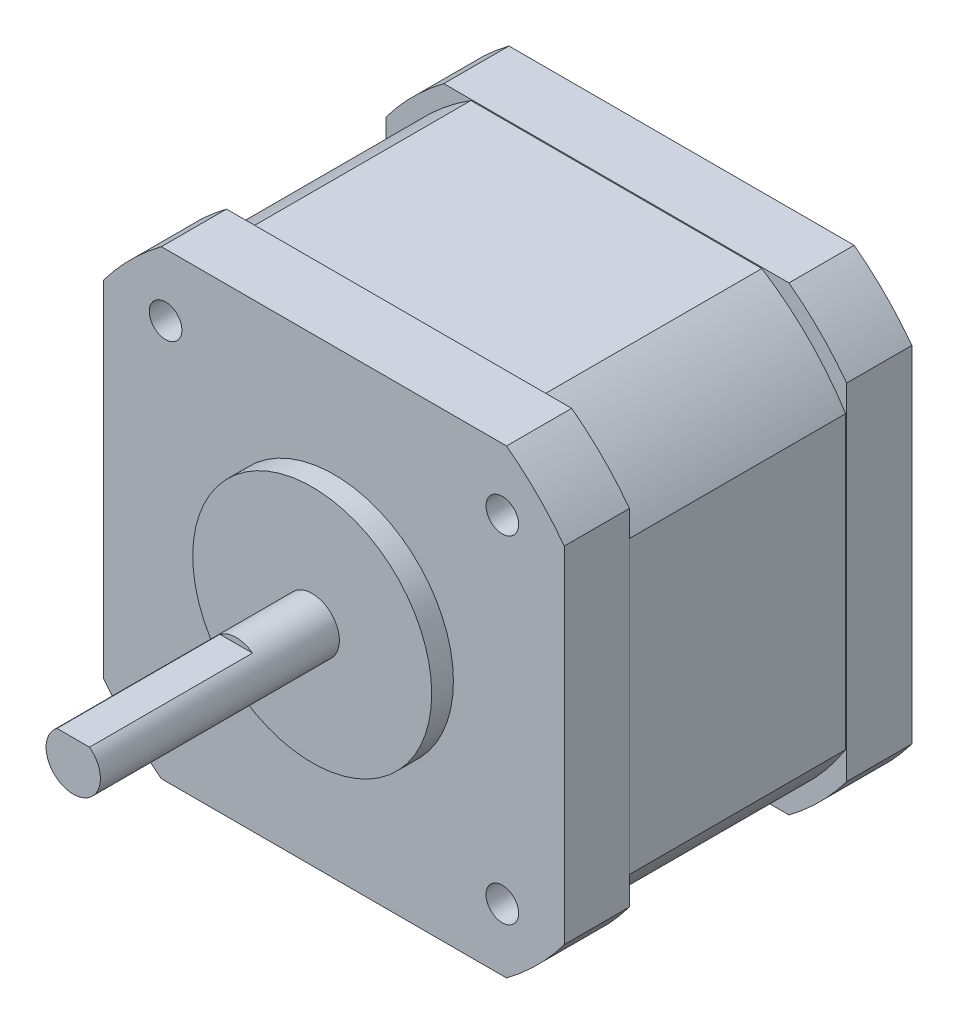
from build123d import *

# Parameters (mm, degrees)
SKETCH1_R                       = 2.5
BOSS_EXTRUDE1_DEPTH             = 24
SKETCH2_R                       = 11
BOSS_EXTRUDE2_DEPTH             = 2
SKETCH3_W                       = 42.418
SKETCH3_H                       = 42.418
BOSS_EXTRUDE3_DEPTH             = 32
CUT_EXTRUDE1_DEPTH              = 64.526713767
M3X0_5_TAPPED_HOLE1_D           = 2.5
M3X0_5_TAPPED_HOLE1_DEPTH       = 7.5
M3X0_5_TAPPED_HOLE1_CBORE_D     = 3
M3X0_5_TAPPED_HOLE1_CBORE_DEPTH = 6
M3X0_5_TAPPED_HOLE1_TIP         = 0.751075774
CUT_EXTRUDE2_START              = -15
CUT_EXTRUDE2_DEPTH              = 15
CUT_EXTRUDE3_DEPTH              = 10


with BuildPart() as part:
    # Sketch1 → Boss-Extrude1 (new body)
    with BuildSketch(Plane.XY):
        Circle(SKETCH1_R)
    extrude(amount=BOSS_EXTRUDE1_DEPTH)

    # Sketch2 → Boss-Extrude2 (add)
    with BuildSketch(Plane(origin=(0, 0, 0), x_dir=(-1, 0, 0), z_dir=(0, 0, -1))):
        Circle(SKETCH2_R)
    extrude(amount=-BOSS_EXTRUDE2_DEPTH)

    # Sketch3 → Boss-Extrude3 (add)
    with BuildSketch(Plane(origin=(0, 0, 0), x_dir=(-1, 0, 0), z_dir=(0, 0, -1))):
        Rectangle(SKETCH3_W, SKETCH3_H)
    extrude(amount=BOSS_EXTRUDE3_DEPTH)

    # Sketch4 → Cut-Extrude1 (cut, through all)
    with BuildSketch(Plane(origin=(0, 0, -32), x_dir=(-1, 0, 0), z_dir=(0, 0, -1))):
        with BuildLine():
            Line((-21.209, -15.887992919), (-21.209, -21.209))
            Line((-21.209, -21.209), (-15.887992919, -21.209))
            ThreePointArc((-15.887992919, -21.209), (-18.738329701, -18.738329701), (-21.209, -15.887992919))
        make_face()
        with BuildLine():
            Line((15.887992919, -21.209), (21.209, -21.209))
            Line((21.209, -21.209), (21.209, -15.887992919))
            ThreePointArc((21.209, -15.887992919), (18.738329701, -18.738329701), (15.887992919, -21.209))
        make_face()
        with BuildLine():
            Line((21.209, 15.887992919), (21.209, 21.209))
            Line((21.209, 21.209), (15.887992919, 21.209))
            ThreePointArc((15.887992919, 21.209), (18.738329701, 18.738329701), (21.209, 15.887992919))
        make_face()
        with BuildLine():
            Line((-15.887992919, 21.209), (-21.209, 21.209))
            Line((-21.209, 21.209), (-21.209, 15.887992919))
            ThreePointArc((-21.209, 15.887992919), (-18.738329701, 18.738329701), (-15.887992919, 21.209))
        make_face()
    extrude(amount=-CUT_EXTRUDE1_DEPTH, mode=Mode.SUBTRACT)

    # M3x0.5 Tapped Hole1
    with Locations(Plane.XY):
        with Locations((-15.5, 15.5), (-15.5, -15.5), (15.5, -15.5), (15.5, 15.5)):
            CounterBoreHole(M3X0_5_TAPPED_HOLE1_D / 2, M3X0_5_TAPPED_HOLE1_CBORE_D / 2, M3X0_5_TAPPED_HOLE1_CBORE_DEPTH, depth=M3X0_5_TAPPED_HOLE1_DEPTH)
            with Locations((0, 0, -(M3X0_5_TAPPED_HOLE1_DEPTH + M3X0_5_TAPPED_HOLE1_TIP / 2))):  # 118° drill point
                Cone(0, M3X0_5_TAPPED_HOLE1_D / 2, M3X0_5_TAPPED_HOLE1_TIP, mode=Mode.SUBTRACT)

    # Sketch7 → Cut-Extrude2 (cut)
    with BuildSketch(Plane.XY.offset(24).offset(CUT_EXTRUDE2_START)):
        with BuildLine():
            Line((-1.5, 2), (1.5, 2))
            ThreePointArc((1.5, 2), (0, 2.5), (-1.5, 2))
        make_face()
    extrude(amount=CUT_EXTRUDE2_DEPTH, mode=Mode.SUBTRACT)

    # Sketch8 → Cut-Extrude3 (cut, symmetric)
    with BuildSketch(Plane.XY.offset(-16)):
        with BuildLine():
            Line((15.887992919, 21.209), (-15.887992919, 21.209))
            ThreePointArc((-15.887992919, 21.209), (-18.738329701, 18.738329701), (-21.209, 15.887992919))
            Line((-21.209, 15.887992919), (-21.209, -15.887992919))
            ThreePointArc((-21.209, -15.887992919), (-18.738329701, -18.738329701), (-15.887992919, -21.209))
            Line((-15.887992919, -21.209), (15.887992919, -21.209))
            ThreePointArc((15.887992919, -21.209), (18.738329701, -18.738329701), (21.209, -15.887992919))
            Line((21.209, -15.887992919), (21.209, 15.887992919))
            ThreePointArc((21.209, 15.887992919), (18.738329701, 18.738329701), (15.887992919, 21.209))
        make_face()
        with BuildLine():
            Line((-13.394406258, 21.109), (13.394406258, 21.109))
            ThreePointArc((13.394406258, 21.109), (17.67766953, 17.67766953), (21.109, 13.394406258))
            Line((21.109, 13.394406258), (21.109, -13.394406258))
            ThreePointArc((21.109, -13.394406258), (17.67766953, -17.67766953), (13.394406258, -21.109))
            Line((13.394406258, -21.109), (-13.394406258, -21.109))
            ThreePointArc((-13.394406258, -21.109), (-17.67766953, -17.67766953), (-21.109, -13.394406258))
            Line((-21.109, -13.394406258), (-21.109, 13.394406258))
            ThreePointArc((-21.109, 13.394406258), (-17.67766953, 17.67766953), (-13.394406258, 21.109))
        make_face(mode=Mode.SUBTRACT)
    extrude(amount=CUT_EXTRUDE3_DEPTH, both=True, mode=Mode.SUBTRACT)


solid = part.part
